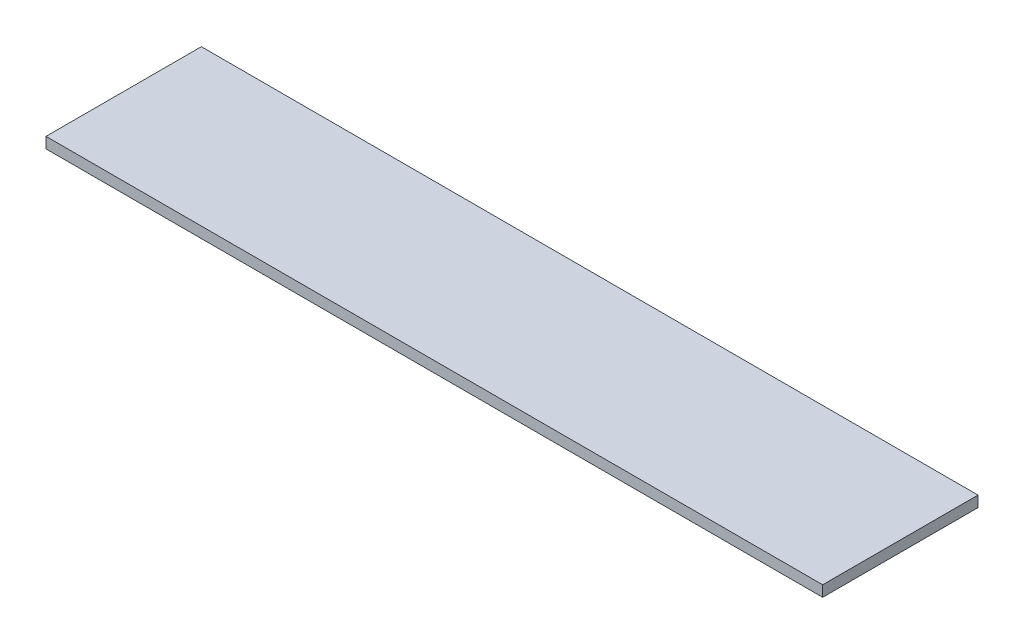
from build123d import *

# Parameters (mm, degrees)
SKETCH1_W           = 50
SKETCH1_H           = 10
BOSS_EXTRUDE1_DEPTH = 0.7


with BuildPart() as part:
    # Sketch1 → Boss-Extrude1 (new body)
    with BuildSketch(Plane(origin=(0, 0, 0), x_dir=(1, 0, 0), z_dir=(0, 1, 0))):
        Rectangle(SKETCH1_W, SKETCH1_H)
    extrude(amount=BOSS_EXTRUDE1_DEPTH)


solid = part.part
